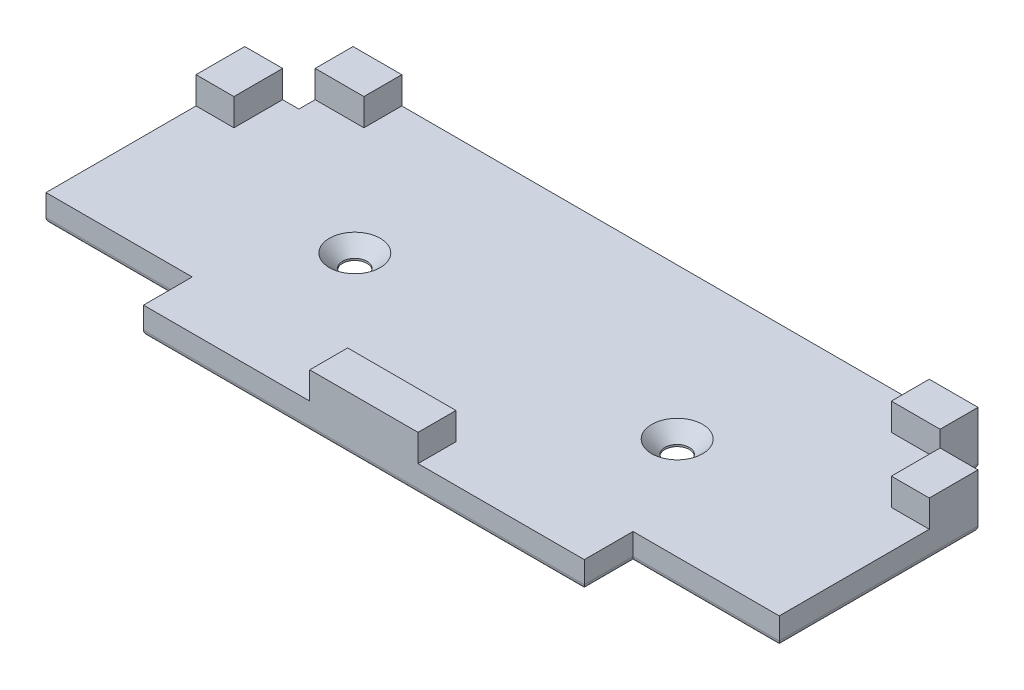
from build123d import *

# Parameters (mm, degrees)
SKETCH1_W                                     = 135.4
SKETCH1_H                                     = 55.7
BOSS_EXTRUDE1_DEPTH                           = 5
SKETCH2_W                                     = 20
SKETCH2_H                                     = 7
BOSS_EXTRUDE2_DEPTH                           = 5
SKETCH3_W                                     = 27
SKETCH3_H                                     = 9
CUT_EXTRUDE1_DEPTH                            = 74.375149063
CSK_FOR_M4_COUNTERSUNK_FLAT_HEAD1_D           = 4.5
CSK_FOR_M4_COUNTERSUNK_FLAT_HEAD1_CSINK_D     = 9.4
CSK_FOR_M4_COUNTERSUNK_FLAT_HEAD1_CSINK_ANGLE = 90
SKETCH7_W                                     = 30
SKETCH7_H                                     = 30
CUT_EXTRUDE2_DEPTH                            = 2.2
SKETCH9_W                                     = 10
SKETCH9_H                                     = 10
CUT_EXTRUDE5_DEPTH                            = 74.88445371
FILLET1_R                                     = 1


with BuildPart() as part:
    # Sketch1 → Boss-Extrude1 (new body)
    with BuildSketch(Plane(origin=(0, 0, 0), x_dir=(1, 0, 0), z_dir=(0, 1, 0))):
        Rectangle(SKETCH1_W, SKETCH1_H)
    extrude(amount=BOSS_EXTRUDE1_DEPTH)

    # Sketch2 → Boss-Extrude2 (add)
    with BuildSketch(Plane(origin=(0, 5, 0), x_dir=(1, 0, 0), z_dir=(0, 1, 0))):
        Polygon((-60.7, 20.85), (-48.7, 20.85), (-48.7, 27.85), (-67.7, 27.85), (-67.7, 8.85), (-60.7, 8.85), align=None)
        with Locations((0, -24.35)):
            Rectangle(SKETCH2_W, SKETCH2_H)
        Polygon((67.7, 27.85), (48.7, 27.85), (48.7, 20.85), (60.7, 20.85), (60.7, 8.85), (67.7, 8.85), align=None)
    extrude(amount=BOSS_EXTRUDE2_DEPTH)

    # Sketch3 → Cut-Extrude1 (cut, through all)
    with BuildSketch(Plane(origin=(0, 5, 0), x_dir=(1, 0, 0), z_dir=(0, 1, 0))):
        with Locations((-54.2, -23.35)):
            Rectangle(SKETCH3_W, SKETCH3_H)
    cut_extrude1 = extrude(amount=-CUT_EXTRUDE1_DEPTH, mode=Mode.SUBTRACT)

    # Mirror1: Cut-Extrude1 across plane
    add(cut_extrude1.mirror(Plane(origin=(0, 0, 0), x_dir=(0, 0, 1), z_dir=(1, 0, 0))), mode=Mode.SUBTRACT)

    # CSK for M4 Countersunk Flat Head1 (through all)
    with Locations(Plane(origin=(-29.527844293, 5, 0), x_dir=(0, 0, 1), z_dir=(0, 1, 0))):
        with Locations((0, 0), (0, 59.527844293)):
            CounterSinkHole(CSK_FOR_M4_COUNTERSUNK_FLAT_HEAD1_D / 2, CSK_FOR_M4_COUNTERSUNK_FLAT_HEAD1_CSINK_D / 2, counter_sink_angle=CSK_FOR_M4_COUNTERSUNK_FLAT_HEAD1_CSINK_ANGLE)

    # Sketch7 → Cut-Extrude2 (cut)
    with BuildSketch(Plane.XZ):
        with Locations((-30, 0)):
            Rectangle(SKETCH7_W, SKETCH7_H)
        with Locations((30, 0)):
            Rectangle(SKETCH7_W, SKETCH7_H)
    extrude(amount=-CUT_EXTRUDE2_DEPTH, mode=Mode.SUBTRACT)

    # Sketch9 → Cut-Extrude5 (cut, through all)
    with BuildSketch(Plane(origin=(0, 10, 0), x_dir=(1, 0, 0), z_dir=(0, 1, 0))):
        with Locations((62.7, 22.85)):
            Rectangle(SKETCH9_W, SKETCH9_H)
    cut_extrude5 = extrude(amount=-CUT_EXTRUDE5_DEPTH, mode=Mode.SUBTRACT)

    # Mirror2: Cut-Extrude5 across plane
    add(cut_extrude5.mirror(Plane(origin=(0, 0, 0), x_dir=(0, 0, 1), z_dir=(1, 0, 0))), mode=Mode.SUBTRACT)

    # Fillet1
    fillet1_edges = [part.edges().sort_by_distance(p)[0] for p in [
        (0, 0, -27.85),
        (62.7, 0, -17.85),
        (57.7, 0, -22.85),
        (-67.7, 0, 0.5),
        (-57.7, 0, -22.85),
        (-62.7, 0, -17.85),
        (0, 0, 27.85),
        (-54.2, 0, 18.85),
        (-40.7, 0, 23.35),
        (67.7, 0, 0.5),
        (40.7, 0, 23.35),
        (54.2, 0, 18.85),
    ]]
    fillet(fillet1_edges, radius=FILLET1_R)


solid = part.part
